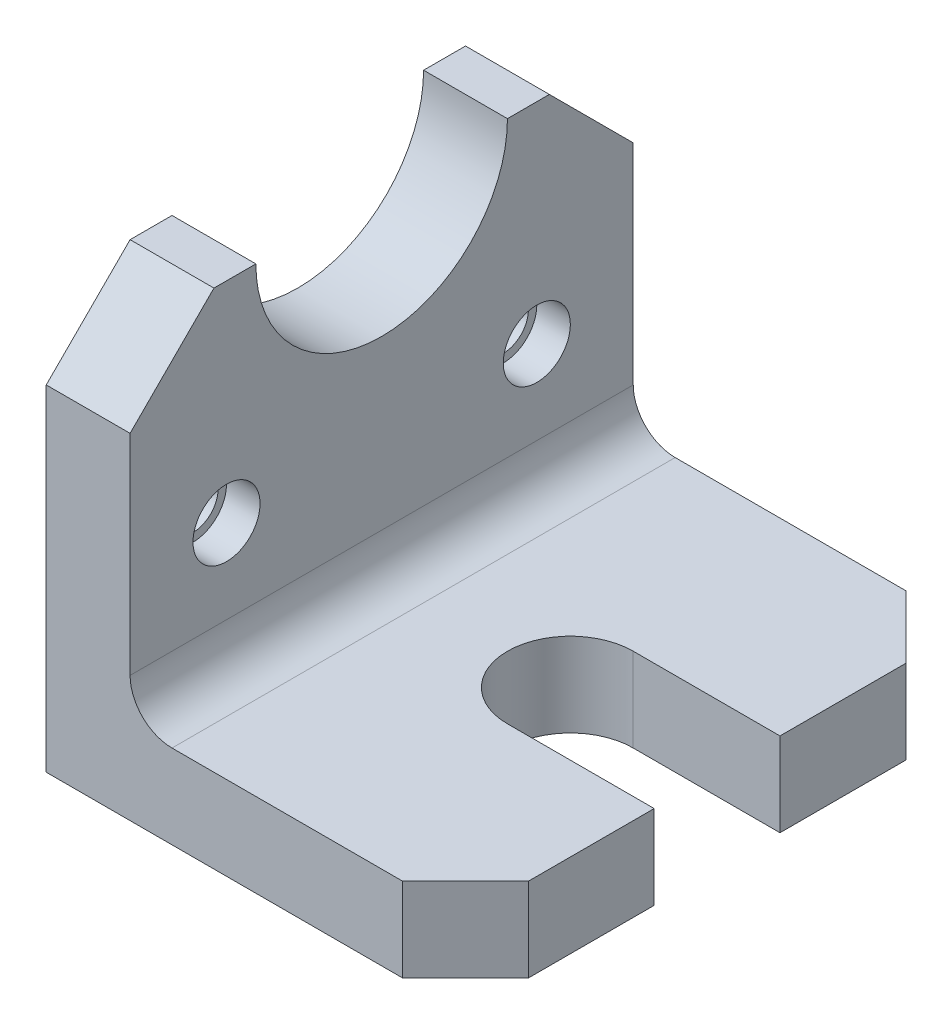
from build123d import *

# Parameters (mm, degrees)
BOSS_EXTRUDE1_DEPTH     = 60
CHAMFER1_SIZE           = 15
CHAMFER2_SIZE           = 20
FILLET2_R               = 10
CUT_EXTRUDE1_REACH      = 143.421
SKETCH2_R               = 6
SKETCH2_3_R             = 8
SKETCH2_3_R_2           = 6
CUT_EXTRUDE2_DEPTH      = 8
CUT_EXTRUDE3_DEPTH      = 142.421356237
CUT_EXTRUDE3_DEPTH_BACK = 20


with BuildPart() as part:
    # Sketch1 → Boss-Extrude1 (new, symmetric)
    with BuildSketch(Plane.XY):
        Polygon((0, 0), (100, 0), (100, 20), (20, 20), (20, 100), (0, 100), align=None)
    extrude(amount=BOSS_EXTRUDE1_DEPTH, both=True)

    # Chamfer1
    chamfer1_edges = [part.edges().sort_by_distance(p)[0] for p in [
        (100, 10, 60),
        (100, 10, -60),
    ]]
    chamfer(chamfer1_edges, length=CHAMFER1_SIZE)

    # Chamfer2
    chamfer2_edges = [part.edges().sort_by_distance(p)[0] for p in [
        (10, 100, 60),
        (10, 100, -60),
    ]]
    chamfer(chamfer2_edges, length=CHAMFER2_SIZE)

    # Fillet2
    fillet2_edges = [part.edges().sort_by_distance(p)[0] for p in [
        (20, 20, 0),
    ]]
    fillet(fillet2_edges, radius=FILLET2_R)

    # Sketch2 → Cut-Extrude1 (cut, up to next)
    with BuildSketch(Plane(origin=(20, 0, 0), x_dir=(0, 0, -1), z_dir=(1, 0, 0)), mode=Mode.PRIVATE) as cut_extrude1_sk1:
        with Locations((-37, 50)):
            Circle(SKETCH2_R)
    cut_extrude1_tool1 = extrude(cut_extrude1_sk1.sketch, amount=-CUT_EXTRUDE1_REACH, mode=Mode.PRIVATE) & part.part
    # Sketch2 → Cut-Extrude1 (cut, up to next)
    with BuildSketch(Plane(origin=(20, 0, 0), x_dir=(0, 0, -1), z_dir=(1, 0, 0)), mode=Mode.PRIVATE) as cut_extrude1_sk2:
        with Locations((37, 50)):
            Circle(SKETCH2_R)
    cut_extrude1_tool2 = extrude(cut_extrude1_sk2.sketch, amount=-CUT_EXTRUDE1_REACH, mode=Mode.PRIVATE) & part.part
    # Sketch2 → Cut-Extrude1 (cut, up to next)
    with BuildSketch(Plane(origin=(20, 0, 0), x_dir=(0, 0, -1), z_dir=(1, 0, 0)), mode=Mode.PRIVATE) as cut_extrude1_sk3:
        with BuildLine():
            Line((30, 100), (-30, 100))
            ThreePointArc((-30, 100), (0, 70), (30, 100))
        make_face()
    cut_extrude1_tool3 = extrude(cut_extrude1_sk3.sketch, amount=-CUT_EXTRUDE1_REACH, mode=Mode.PRIVATE) & part.part
    add(cut_extrude1_tool1.solids().sort_by_distance((20, 50, 37))[0], mode=Mode.SUBTRACT)
    add(cut_extrude1_tool2.solids().sort_by_distance((20, 50, -37))[0], mode=Mode.SUBTRACT)
    add(cut_extrude1_tool3.solids().sort_by_distance((20, 87.267605, 0))[0], mode=Mode.SUBTRACT)

    # Sketch2<3> → Cut-Extrude2 (cut)
    # profile 1 of 2: a face of its own
    with BuildSketch(Plane(origin=(20, 0, 0), x_dir=(0, 0, -1), z_dir=(1, 0, 0))):
        with Locations((-37, 50)):
            Circle(SKETCH2_3_R)
        with Locations((-37, 50)):
            Circle(SKETCH2_3_R_2, mode=Mode.SUBTRACT)
    # profile 2 of 2: a face of its own
    with BuildSketch(Plane(origin=(20, 0, 0), x_dir=(0, 0, -1), z_dir=(1, 0, 0))):
        with Locations((37, 50)):
            Circle(SKETCH2_3_R)
        with Locations((37, 50)):
            Circle(SKETCH2_3_R_2, mode=Mode.SUBTRACT)
    extrude(amount=-CUT_EXTRUDE2_DEPTH, mode=Mode.SUBTRACT)

    # Sketch3 → Cut-Extrude3 (cut, two sides: drawn at the far end of the back side and taken through both)
    with BuildSketch(Plane(origin=(0, 20, 0), x_dir=(1, 0, 0), z_dir=(0, 1, 0)).offset(-CUT_EXTRUDE3_DEPTH_BACK)):
        with BuildLine():
            Line((360, 15), (100, 15))
            Line((100, 15), (65, 15))
            ThreePointArc((65, 15), (50, 0), (65, -15))
            Line((65, -15), (100, -15))
            Line((100, -15), (360, -15))
            Line((360, -15), (880, -15))
            Line((880, -15), (880, 15))
            Line((880, 15), (360, 15))
        make_face()
    extrude(amount=CUT_EXTRUDE3_DEPTH + CUT_EXTRUDE3_DEPTH_BACK, mode=Mode.SUBTRACT)


solid = part.part
